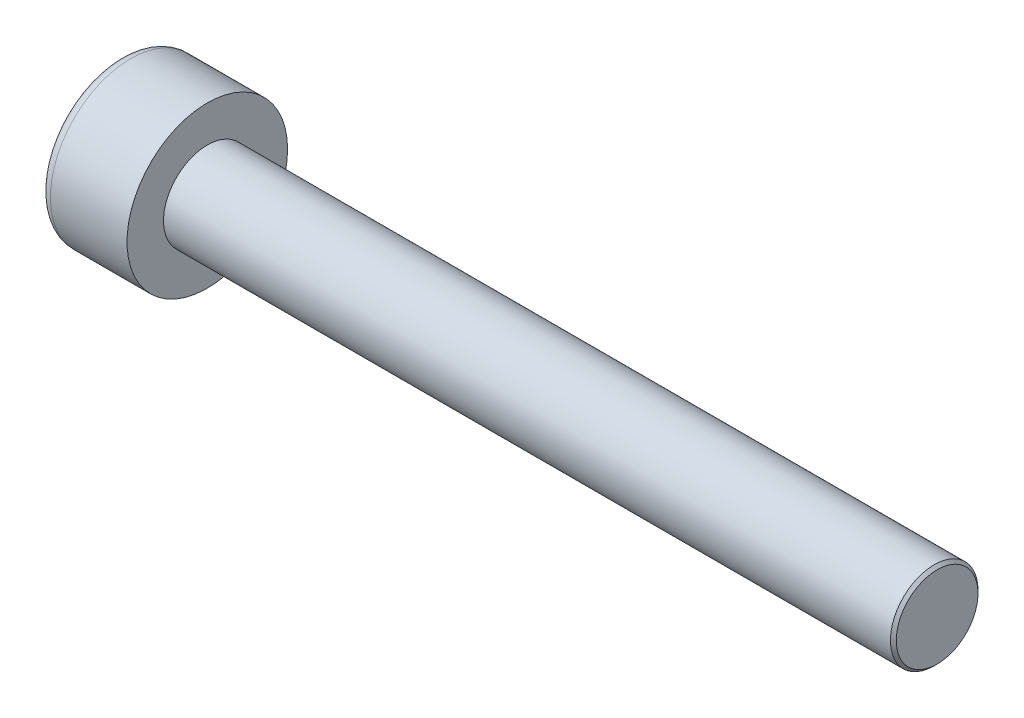
from build123d import *

# Parameters (mm, degrees)
SKETCH1_R           = 2.75
BASEHEAD_DEPTH      = 3
SKETCH2_R           = 1.5
BASEBODY_DEPTH      = 25
HEXAGONSOCKET_DEPTH = 1.3
TOPFILLET_R         = 0.375
CHAMFER1_SIZE       = 0.1


with BuildPart() as part:
    # Sketch1 → BaseHead (new body)
    with BuildSketch(Plane(origin=(0, 0, 0), x_dir=(0, 0, -1), z_dir=(1, 0, 0))):
        Circle(SKETCH1_R)
    extrude(amount=BASEHEAD_DEPTH)

    # Sketch2 → BaseBody (add)
    with BuildSketch(Plane(origin=(3, 0, 0), x_dir=(0, 0, -1), z_dir=(1, 0, 0))):
        Circle(SKETCH2_R)
    extrude(amount=BASEBODY_DEPTH)

    # Sketch3 → HexagonSocket (cut)
    with BuildSketch(Plane(origin=(0, 0, 0), x_dir=(0, 0, -1), z_dir=(1, 0, 0))):
        Polygon((1.443375673, 0), (0.721687836, 1.25), (-0.721687836, 1.25), (-1.443375673, 0), (-0.721687836, -1.25), (0.721687836, -1.25), align=None)
    extrude(amount=HEXAGONSOCKET_DEPTH, mode=Mode.SUBTRACT)

    # Sketch4 → Cut-Revolve1 (revolve, cut)
    with BuildSketch(Plane(origin=(-4.19613823, 0.75, 0), x_dir=(-1, 0, 0), z_dir=(0, 0, 1)), mode=Mode.PRIVATE) as cut_revolve1_sk:
        Polygon((-5.49613823, 2), (-6.217826066, 0.75), (-5.49613823, 0.75), align=None)
    revolve(cut_revolve1_sk.sketch.rotate(Axis((0.838992387, 0, 0), (-1, 0, 0)), 90), axis=Axis((0.838992387, 0, 0), (-1, 0, 0)), mode=Mode.SUBTRACT)

    # TopFillet
    topfillet_edges = [part.edges().sort_by_distance(p)[0] for p in [
        (0, 0, 2.75),
    ]]
    fillet(topfillet_edges, radius=TOPFILLET_R)

    # Chamfer1
    chamfer1_edges = [part.edges().sort_by_distance(p)[0] for p in [
        (28, 0, 1.5),
    ]]
    chamfer(chamfer1_edges, length=CHAMFER1_SIZE)


solid = part.part
